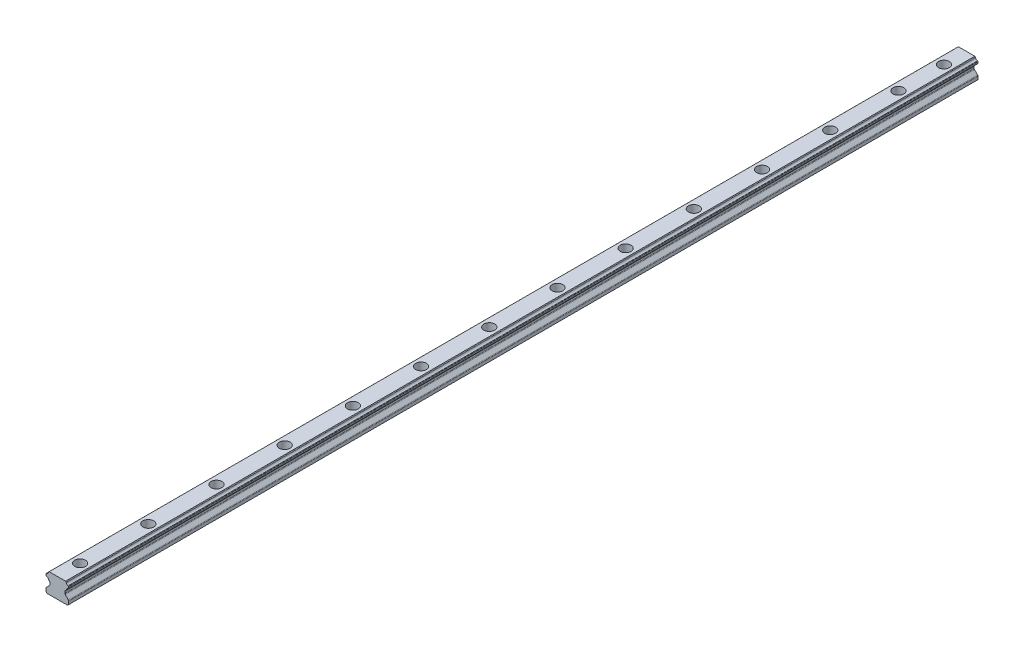
from build123d import *

# Parameters (mm, degrees)
BODY_DEPTH                     = 400
CBORE_FOR_M6_SHCS1_D           = 6
CBORE_FOR_M6_SHCS1_CBORE_D     = 9.5
CBORE_FOR_M6_SHCS1_CBORE_DEPTH = 8.4
LP_CBORE_COUNT                 = 13
LP_CBORE_PITCH                 = 60


with BuildPart() as part:
    # Sketch10 → BODY (new, symmetric)
    with BuildSketch(Plane.XY):
        with BuildLine():
            Line((-10, -10.338492954), (-10, -13))
            Line((-10, -13), (-9, -14))
            Line((-9, -14), (9, -14))
            Line((9, -14), (10, -13))
            Line((10, -13), (10, -10.338492954))
            ThreePointArc((10, -10.338492954), (9.92387953, -9.955809511), (9.707106773, -9.631386153))
            Line((9.707106773, -9.631386153), (6.892893227, -6.817172607))
            ThreePointArc((6.892893227, -6.817172607), (6.67612047, -6.492749249), (6.6, -6.110065806))
            Line((6.6, -6.110065806), (6.6, -4.549934184))
            ThreePointArc((6.6, -4.549934184), (6.67612047, -4.167250741), (6.892893227, -3.842827383))
            Line((6.892893227, -3.842827383), (7.63016236, -3.10555825))
            ThreePointArc((7.63016236, -3.10555825), (7.773916138, -2.959214094), (7.846806387, -2.767462244))
            ThreePointArc((7.846806387, -2.767462244), (8.396388302, -1.732072251), (9.431778289, -1.182490324))
            ThreePointArc((9.431778289, -1.182490324), (9.571491848, -1.133183298), (9.690622384, -1.045098244))
            Line((9.690622384, -1.045098244), (9.85355341, -0.8821672))
            ThreePointArc((9.85355341, -0.8821672), (9.961939771, -0.719955532), (10, -0.528613829))
            Line((10, -0.528613829), (10, 0.528613829))
            ThreePointArc((10, 0.528613829), (9.961939771, 0.719955532), (9.85355341, 0.8821672))
            Line((9.85355341, 0.8821672), (9.690622384, 1.045098244))
            ThreePointArc((9.690622384, 1.045098244), (9.568212021, 1.140675288), (9.422379794, 1.194081559))
            ThreePointArc((9.422379794, 1.194081559), (8.396063845, 1.741777545), (7.848162084, 2.767983656))
            ThreePointArc((7.848162084, 2.767983656), (7.775191193, 2.958001329), (7.63253117, 3.10318943))
            Line((7.63253117, 3.10318943), (7.2357206, 3.5))
            Line((7.2357206, 3.5), (-7.2357206, 3.5))
            Line((-7.2357206, 3.5), (-7.63253117, 3.10318943))
            ThreePointArc((-7.63253117, 3.10318943), (-7.775191193, 2.958001329), (-7.848162084, 2.767983656))
            ThreePointArc((-7.848162084, 2.767983656), (-8.396063845, 1.741777545), (-9.422379794, 1.194081559))
            ThreePointArc((-9.422379794, 1.194081559), (-9.568212021, 1.140675288), (-9.690622384, 1.045098244))
            Line((-9.690622384, 1.045098244), (-9.85355341, 0.8821672))
            ThreePointArc((-9.85355341, 0.8821672), (-9.961939771, 0.719955532), (-10, 0.528613829))
            Line((-10, 0.528613829), (-10, -0.528613829))
            ThreePointArc((-10, -0.528613829), (-9.961939771, -0.719955532), (-9.85355341, -0.8821672))
            Line((-9.85355341, -0.8821672), (-9.690622384, -1.045098244))
            ThreePointArc((-9.690622384, -1.045098244), (-9.571491848, -1.133183298), (-9.431778289, -1.182490324))
            ThreePointArc((-9.431778289, -1.182490324), (-8.396388302, -1.732072251), (-7.846806387, -2.767462244))
            ThreePointArc((-7.846806387, -2.767462244), (-7.773916138, -2.959214094), (-7.63016236, -3.10555825))
            Line((-7.63016236, -3.10555825), (-6.892893227, -3.842827383))
            ThreePointArc((-6.892893227, -3.842827383), (-6.67612047, -4.167250741), (-6.6, -4.549934184))
            Line((-6.6, -4.549934184), (-6.6, -6.110065806))
            ThreePointArc((-6.6, -6.110065806), (-6.67612047, -6.492749249), (-6.892893227, -6.817172607))
            Line((-6.892893227, -6.817172607), (-9.707106773, -9.631386153))
            ThreePointArc((-9.707106773, -9.631386153), (-9.92387953, -9.955809511), (-10, -10.338492954))
        make_face()
    extrude(amount=BODY_DEPTH, both=True)

    # CBORE for M6 SHCS1 (through all)
    with Locations(Plane(origin=(0, 3.5, 0), x_dir=(1, 0, 0), z_dir=(0, 1, 0))):
        with Locations((0, -380)):
            cbore_for_m6_shcs1 = CounterBoreHole(CBORE_FOR_M6_SHCS1_D / 2, CBORE_FOR_M6_SHCS1_CBORE_D / 2, CBORE_FOR_M6_SHCS1_CBORE_DEPTH)

    # MIRROR FIRST COUNTERBORE: CBORE for M6 SHCS1 across plane
    add(cbore_for_m6_shcs1.mirror(Plane.XY), mode=Mode.SUBTRACT)

    # LP CBORE: CBORE for M6 SHCS1 ×13
    with Locations(*[(0, 0, -i * LP_CBORE_PITCH) for i in range(1, LP_CBORE_COUNT)]):
        add(cbore_for_m6_shcs1, mode=Mode.SUBTRACT)


solid = part.part
